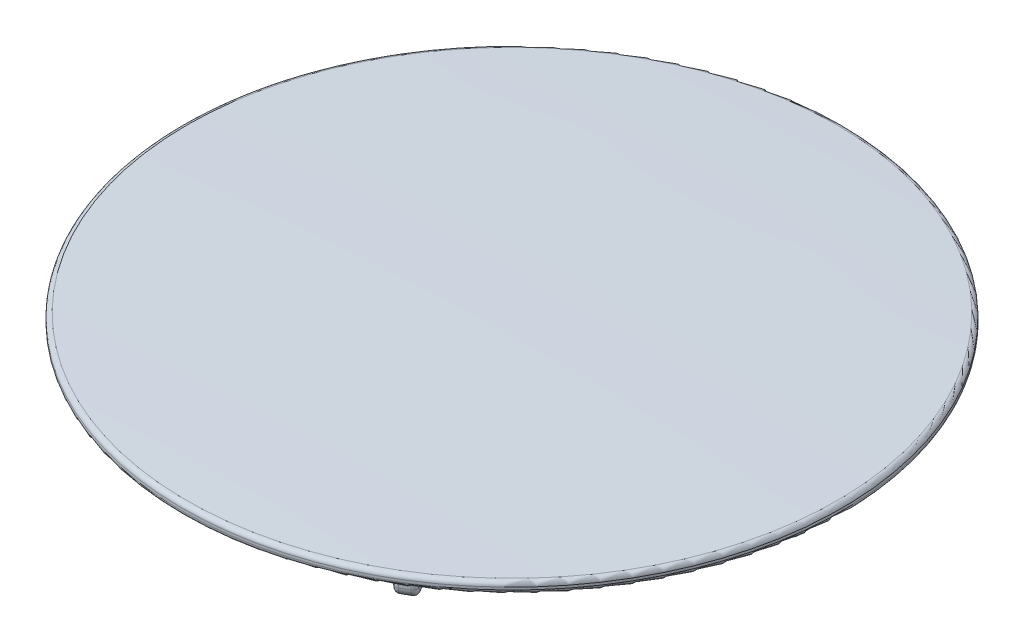
from build123d import *

# Parameters (mm, degrees)
COVERFILLET_R         = 0.79375
LEGBOSS_EXTRUDE_DEPTH = 1.5875
LEGPROFILEFILLET_R    = 1.5875
LEGSIDESFILLET_R      = 0.79375
LEGSCIRPATTERN_COUNT  = 6


with BuildPart() as part:
    # DrainCoverSketch → CoverRevolve (revolve)
    with BuildSketch(Plane.XY.offset(-317.5)):
        with BuildLine():
            Line((685.8, -220.6625), (742.95, -220.6625))
            Line((742.95, -220.6625), (742.95, -218.678125))
            ThreePointArc((742.95, -218.678125), (714.381200499, -217.785188541), (685.8, -217.4875))
            Line((685.8, -217.4875), (685.8, -220.6625))
        make_face()
    revolve(axis=Axis((685.8, -217.4875, -317.5), (0, -1, 0)))

    # CoverFillet
    coverfillet_edges = [part.edges().sort_by_distance(p)[0] for p in [
        (628.65, -218.678125, -317.5),
        (628.65, -220.6625, -317.5),
    ]]
    fillet(coverfillet_edges, radius=COVERFILLET_R)


with BuildPart() as body_2:
    # DrainCoverSketch<5> → LegBoss-Extrude (new, symmetric)
    with BuildSketch(Plane.XY.offset(-317.5)):
        Polygon((736.6, -220.6625), (720.725, -220.6625), (720.725, -233.3625), (725.4875, -233.3625), (725.4875, -227.0125), (736.6, -227.0125), align=None)
    extrude(amount=LEGBOSS_EXTRUDE_DEPTH, both=True)

    # LegProfileFillet
    legprofilefillet_edges = [body_2.edges().sort_by_distance(p)[0] for p in [
        (725.4875, -227.0125, -317.5),
        (736.6, -227.0125, -317.5),
        (720.725, -233.3625, -317.5),
        (725.4875, -233.3625, -317.5),
    ]]
    fillet(legprofilefillet_edges, radius=LEGPROFILEFILLET_R)

    # LegSidesFillet
    legsidesfillet_edges = [body_2.edges().sort_by_distance(p)[0] for p in [
        (736.6, -223.04375, -319.0875),
        (736.6, -223.04375, -315.9125),
        (725.4875, -230.1875, -319.0875),
        (725.4875, -230.1875, -315.9125),
        (723.10625, -233.3625, -319.0875),
        (723.10625, -233.3625, -315.9125),
        (720.725, -226.21875, -319.0875),
        (720.725, -226.21875, -315.9125),
        (736.135032015, -226.547532015, -319.0875),
        (731.04375, -227.0125, -319.0875),
        (725.952467985, -227.477467985, -319.0875),
        (725.022532015, -232.897532015, -319.0875),
        (721.189967985, -232.897532015, -319.0875),
        (736.135032015, -226.547532015, -315.9125),
        (731.04375, -227.0125, -315.9125),
        (725.952467985, -227.477467985, -315.9125),
        (725.022532015, -232.897532015, -315.9125),
        (721.189967985, -232.897532015, -315.9125),
    ]]
    fillet(legsidesfillet_edges, radius=LEGSIDESFILLET_R)


with BuildPart() as legscirpattern_1:
    # LegsCirPattern: pattern copy
    add(body_2.part.rotate(Axis((685.8, -220.6625, -317.5), (0, -1, 0)), 1 * 360 / LEGSCIRPATTERN_COUNT))


with BuildPart() as legscirpattern_2:
    # LegsCirPattern: pattern copy
    add(body_2.part.rotate(Axis((685.8, -220.6625, -317.5), (0, -1, 0)), 2 * 360 / LEGSCIRPATTERN_COUNT))


with BuildPart() as legscirpattern_3:
    # LegsCirPattern: pattern copy
    add(body_2.part.rotate(Axis((685.8, -220.6625, -317.5), (0, -1, 0)), 3 * 360 / LEGSCIRPATTERN_COUNT))


with BuildPart() as legscirpattern_4:
    # LegsCirPattern: pattern copy
    add(body_2.part.rotate(Axis((685.8, -220.6625, -317.5), (0, -1, 0)), 4 * 360 / LEGSCIRPATTERN_COUNT))


with BuildPart() as legscirpattern_5:
    # LegsCirPattern: pattern copy
    add(body_2.part.rotate(Axis((685.8, -220.6625, -317.5), (0, -1, 0)), 5 * 360 / LEGSCIRPATTERN_COUNT))


with BuildPart() as part_1:
    add(part.part)

    # CoverCombine: union LegsCirPattern_2, LegsCirPattern_1, body 2, LegsCirPattern_5, LegsCirPattern_4, LegsCirPattern_3
    add(legscirpattern_2.part)
    add(legscirpattern_1.part)
    add(body_2.part)
    add(legscirpattern_5.part)
    add(legscirpattern_4.part)
    add(legscirpattern_3.part)


solid = part_1.part
